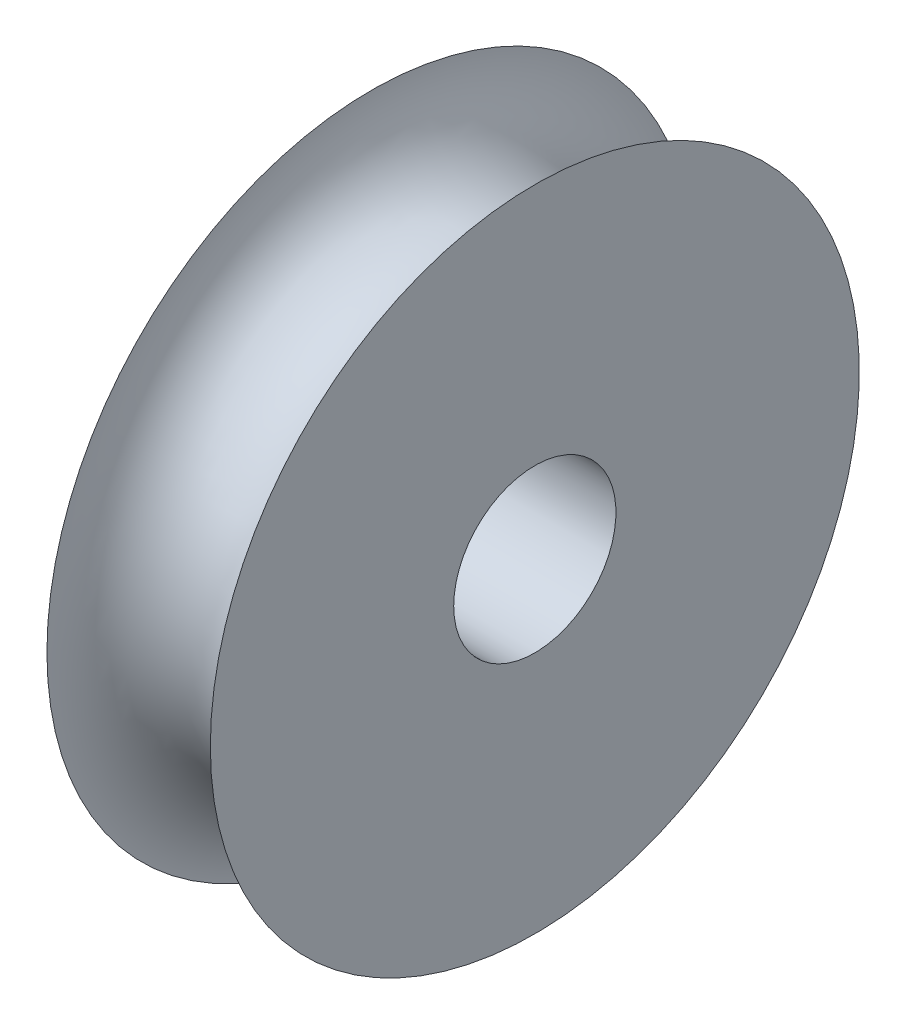
from build123d import *


with BuildPart() as part:
    # Sweep2: sweep along a path in Sketch1
    with BuildLine(Plane(origin=(0, 0, 0), x_dir=(0, 0, -1), z_dir=(1, 0, 0))) as sweep2_path:
        CenterArc((0, 0), 25.4, 0, 360)
    # Sketch3 → Sweep2 (sweep)
    with BuildSketch(Plane.XY):
        with BuildLine():
            Line((0, 25.4), (0, 6.35))
            Line((0, 6.35), (12.791280175, 6.35))
            Line((12.791280175, 6.35), (12.791280175, 25.4))
            ThreePointArc((12.791280175, 25.4), (6.395640088, 19.004359912), (0, 25.4))
        make_face()
    sweep(path=sweep2_path.line)


solid = part.part
